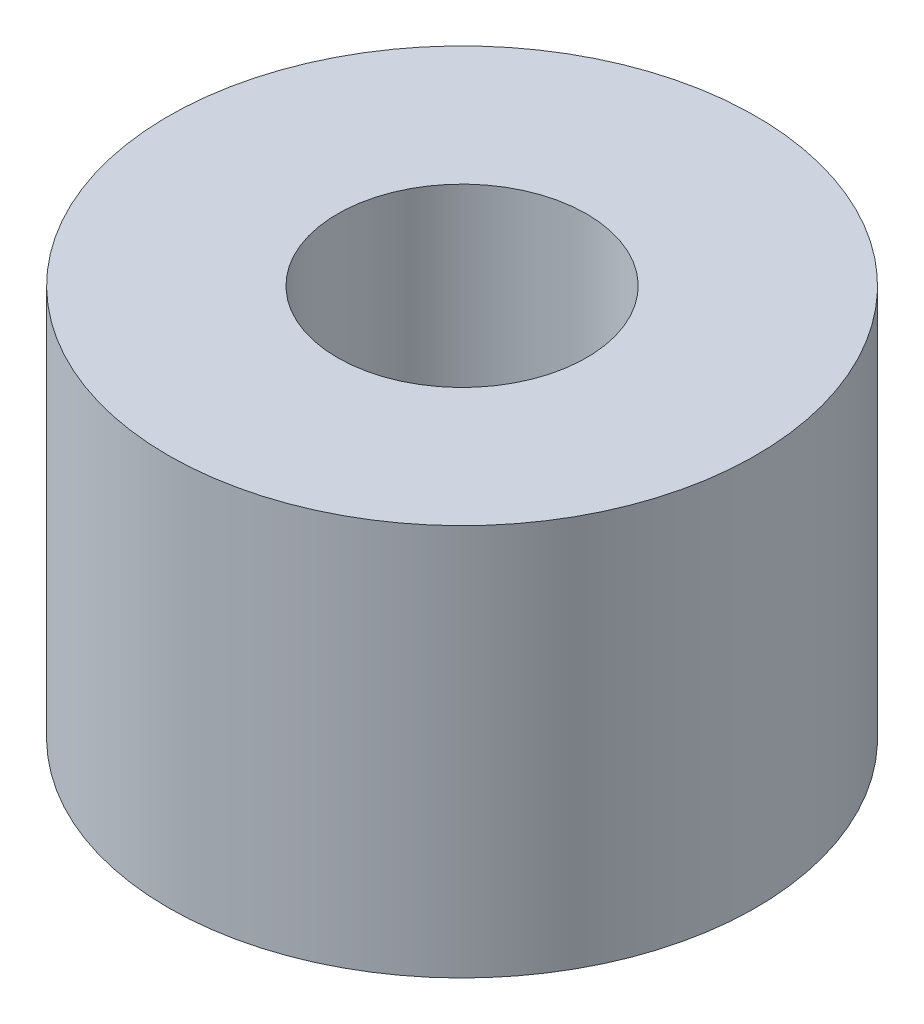
from build123d import *

# Parameters (mm, degrees)
SKETCH1_R              = 4.7625
SKETCH1_R_2            = 0.635
BOSS_EXTRUDE1_DEPTH    = 6.35
F_10_32_TAPPED_HOLE1_D = 4.0386


with BuildPart() as part:
    # Sketch1 → Boss-Extrude1 (new body)
    with BuildSketch(Plane(origin=(0, 0, 0), x_dir=(1, 0, 0), z_dir=(0, 1, 0))):
        with Locations(Location((0, 0, 0), (0, 0, 270))):
            Circle(SKETCH1_R)
        with Locations(Location((0, 0, 0), (0, 0, 270))):
            Circle(SKETCH1_R_2, mode=Mode.SUBTRACT)
    extrude(amount=BOSS_EXTRUDE1_DEPTH)

    # #10-32 Tapped Hole1 (through all)
    with Locations(Plane(origin=(0, 6.35, 0), x_dir=(1, 0, 0), z_dir=(0, 1, 0))):
        with Locations((0, 0)):
            Hole(F_10_32_TAPPED_HOLE1_D / 2)


solid = part.part
